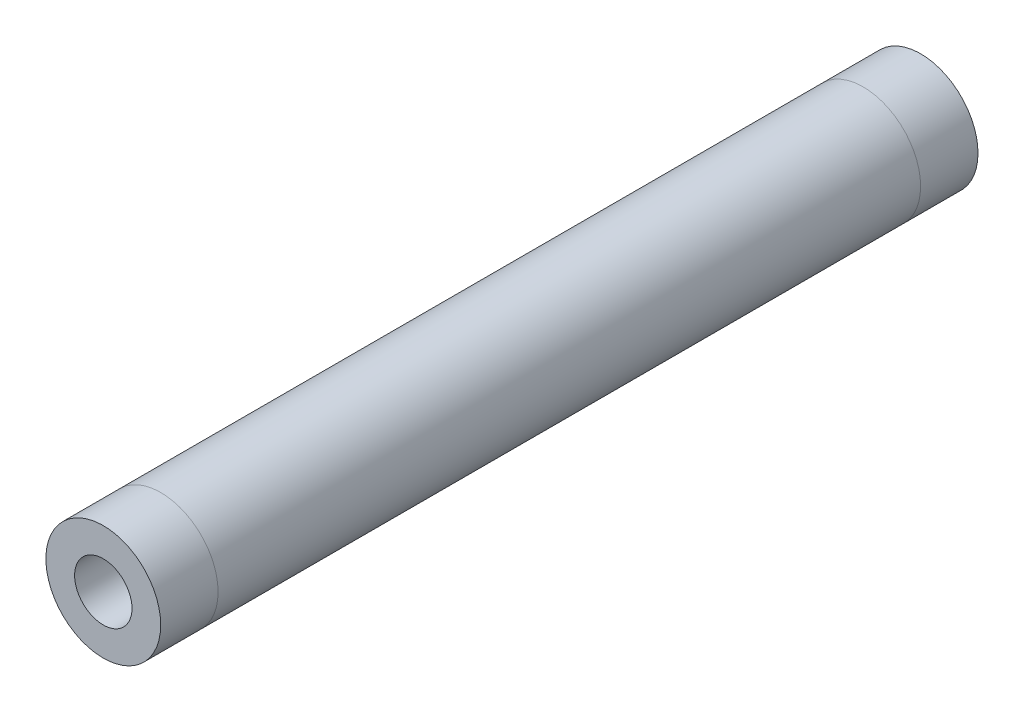
from build123d import *

# Parameters (mm, degrees)
THREADED_START            = -21.9075
SKETCH2_R                 = 6.35
SKETCH2_R_2               = 4.7625
SKETCH2_R_3               = 3.175
THREADED_INSERT_1_1_DEPTH = 6.35
THREADED_START_2          = -28.2575
SKETCH2_5_R               = 4.7625
SKETCH2_5_R_2             = 3.175
THREADED_INSERT_1_2_DEPTH = 6.35
BOSS_EXTRUDE4_START       = -112.328185
SKETCH2_7_R               = 6.35
SKETCH2_7_R_2             = 4.7625
SKETCH2_7_R_3             = 3.175
BOSS_EXTRUDE4_DEPTH       = 6.35
BOSS_EXTRUDE5_START       = -99.628185
SKETCH2_8_R               = 4.7625
SKETCH2_8_R_2             = 3.175
BOSS_EXTRUDE5_DEPTH       = 6.35
BOSS_EXTRUDE6_START       = -28.2575
SKETCH2_9_R               = 6.35
SKETCH2_9_R_2             = 4.7625
BOSS_EXTRUDE6_DEPTH       = 77.720684792


with BuildPart() as part:
    # Sketch2 → Threaded Insert 1-1 (new body)
    # profile 1 of 2: a face of its own
    with BuildSketch(Plane.XY.offset(THREADED_START)):
        Circle(SKETCH2_R)
        Circle(SKETCH2_R_2, mode=Mode.SUBTRACT)
    # profile 2 of 2: a face of its own
    with BuildSketch(Plane.XY.offset(THREADED_START)):
        Circle(SKETCH2_R_2)
        Circle(SKETCH2_R_3, mode=Mode.SUBTRACT)
    extrude(amount=-THREADED_INSERT_1_1_DEPTH)

    # Sketch2<5> → Threaded Insert 1-2 (add)
    with BuildSketch(Plane.XY.offset(THREADED_START_2)):
        Circle(SKETCH2_5_R)
        Circle(SKETCH2_5_R_2, mode=Mode.SUBTRACT)
    extrude(amount=-THREADED_INSERT_1_2_DEPTH)


with BuildPart() as body_2:
    # Sketch2<7> → Boss-Extrude4 (new body)
    # profile 1 of 2: a face of its own
    with BuildSketch(Plane.XY.offset(BOSS_EXTRUDE4_START)):
        Circle(SKETCH2_7_R)
        Circle(SKETCH2_7_R_2, mode=Mode.SUBTRACT)
    # profile 2 of 2: a face of its own
    with BuildSketch(Plane.XY.offset(BOSS_EXTRUDE4_START)):
        Circle(SKETCH2_7_R_2)
        Circle(SKETCH2_7_R_3, mode=Mode.SUBTRACT)
    extrude(amount=BOSS_EXTRUDE4_DEPTH)

    # Sketch2<8> → Boss-Extrude5 (add)
    with BuildSketch(Plane.XY.offset(BOSS_EXTRUDE5_START)):
        Circle(SKETCH2_8_R)
        Circle(SKETCH2_8_R_2, mode=Mode.SUBTRACT)
    extrude(amount=-BOSS_EXTRUDE5_DEPTH)


with BuildPart() as body_3:
    # Sketch2<9> → Boss-Extrude6 (new body)
    with BuildSketch(Plane.XY.offset(BOSS_EXTRUDE6_START)):
        Circle(SKETCH2_9_R)
        Circle(SKETCH2_9_R_2, mode=Mode.SUBTRACT)
    extrude(amount=-BOSS_EXTRUDE6_DEPTH)


solid = Compound([part.part, body_2.part, body_3.part])
